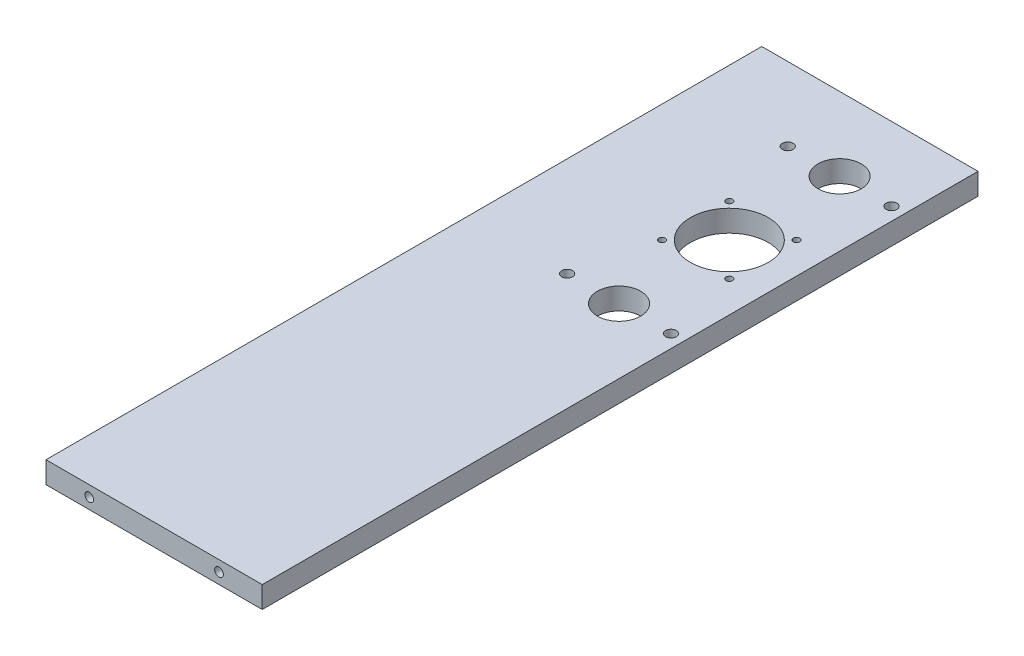
from build123d import *

# Parameters (mm, degrees)
SKETCH1_W           = 100
SKETCH1_H           = 331
BOSS_EXTRUDE1_DEPTH = 10
SKETCH2_R           = 10
SKETCH2_R_2         = 2.5
SKETCH2_R_3         = 18
SKETCH2_R_4         = 1.5
CUT_EXTRUDE1_DEPTH  = 311.286961886
SKETCH3_R           = 2
CUT_EXTRUDE2_DEPTH  = 15


with BuildPart() as part:
    # Sketch1 → Boss-Extrude1 (new body)
    with BuildSketch(Plane(origin=(0, 0, 0), x_dir=(1, 0, 0), z_dir=(0, 1, 0))):
        with Locations((-29.223933498, -134.335900248)):
            Rectangle(SKETCH1_W, SKETCH1_H)
    extrude(amount=BOSS_EXTRUDE1_DEPTH)

    # Sketch2 → Cut-Extrude1 (cut, through all)
    with BuildSketch(Plane(origin=(0, 10, 0), x_dir=(1, 0, 0), z_dir=(0, 1, 0))):
        with Locations(Location((-9.223933498, -2.835900248, 0), (0, 0, 270))):
            Circle(SKETCH2_R)
        with Locations(Location((-33.223933498, -2.835900248, 0), (0, 0, 270))):
            Circle(SKETCH2_R_2)
        with Locations(Location((14.776066502, -2.835900248, 0), (0, 0, 270))):
            Circle(SKETCH2_R_2)
        with Locations(Location((-9.223933498, -104.835900248, 0), (0, 0, 270))):
            Circle(SKETCH2_R)
        with Locations(Location((-33.223933498, -104.835900248, 0), (0, 0, 270))):
            Circle(SKETCH2_R_2)
        with Locations(Location((14.776066502, -104.835900248, 0), (0, 0, 270))):
            Circle(SKETCH2_R_2)
        with Locations(Location((-9.223933498, -53.835900248, 0), (0, 0, 270))):
            Circle(SKETCH2_R_3)
        with Locations(Location((6.332415688, -38.279551062, 0), (0, 0, 270))):
            Circle(SKETCH2_R_4)
        with Locations(Location((6.332415688, -69.392249434, 0), (0, 0, 270))):
            Circle(SKETCH2_R_4)
        with Locations(Location((-24.780282685, -69.392249434, 0), (0, 0, 270))):
            Circle(SKETCH2_R_4)
        with Locations(Location((-24.780282685, -38.279551062, 0), (0, 0, 270))):
            Circle(SKETCH2_R_4)
    extrude(amount=-CUT_EXTRUDE1_DEPTH, mode=Mode.SUBTRACT)

    # Sketch3 → Cut-Extrude2 (cut)
    with BuildSketch(Plane.XY.offset(299.835900248)):
        with Locations((-59.223933498, 5)):
            Circle(SKETCH3_R)
        with Locations((0.776066502, 5)):
            Circle(SKETCH3_R)
    extrude(amount=-CUT_EXTRUDE2_DEPTH, mode=Mode.SUBTRACT)


solid = part.part
